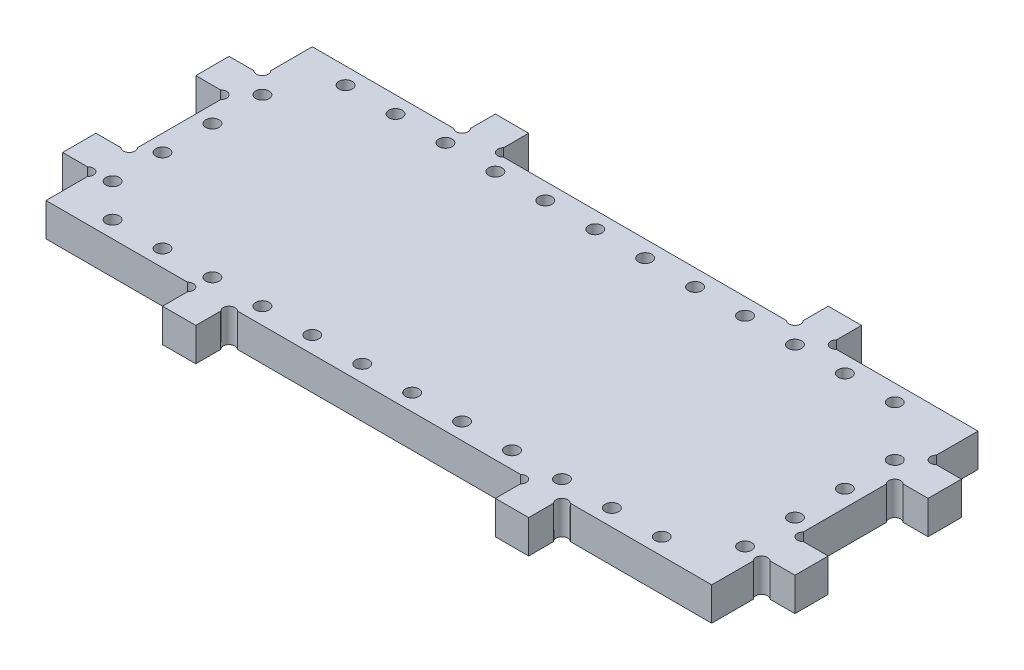
from build123d import *

# Parameters (mm, degrees)
SKETCH2_W                  = 254
SKETCH2_H                  = 101.6
RECTANGLE_EXTRUSION_DEPTH  = 12.7
SKETCH4_W                  = 12.7
SKETCH4_H                  = 12.7
FRONT_FACE_TABS_DEPTH      = 12.7
SKETCH6_R                  = 2.24536
TAB_CURVE_FRONT_BACK_DEPTH = 12.7
SKETCH7_W                  = 12.7
SKETCH7_H                  = 12.7
RIGHT_FACE_TABS_DEPTH      = 12.7
SKETCH8_R                  = 2.24536
TAB_CURVE_LEFT_RIGHT_DEPTH = 12.7
SKETCH9_R                  = 2.5527
CUT_EXTRUDE1_DEPTH         = 154.979316793


with BuildPart() as part:
    # Sketch2 → Rectangle Extrusion (new body)
    with BuildSketch(Plane(origin=(0, 0, 0), x_dir=(1, 0, 0), z_dir=(0, 1, 0))):
        Rectangle(SKETCH2_W, SKETCH2_H)
    extrude(amount=RECTANGLE_EXTRUSION_DEPTH)

    # Sketch4 → Front Face Tabs (add)
    with BuildSketch(Plane.XY.offset(50.8)):
        with Locations((-63.5, 6.35)):
            Rectangle(SKETCH4_W, SKETCH4_H)
        with Locations((63.5, 6.35)):
            Rectangle(SKETCH4_W, SKETCH4_H)
    front_face_tabs = extrude(amount=FRONT_FACE_TABS_DEPTH)

    # Mirror Rear Face Tabs: Front Face Tabs across plane
    add(front_face_tabs.mirror(Plane.XY))

    # Sketch6 → Tab Curve Front Back (cut)
    with BuildSketch(Plane(origin=(0, 12.7, 0), x_dir=(1, 0, 0), z_dir=(0, 1, 0))):
        with Locations((-71.4375, 52.3875)):
            Circle(SKETCH6_R)
        with Locations((-55.5625, 52.3875)):
            Circle(SKETCH6_R)
        with Locations((55.5625, 52.3875)):
            Circle(SKETCH6_R)
        with Locations((71.4375, 52.3875)):
            Circle(SKETCH6_R)
        with Locations((71.4375, -52.3875)):
            Circle(SKETCH6_R)
        with Locations((55.5625, -52.3875)):
            Circle(SKETCH6_R)
        with Locations((-55.5625, -52.3875)):
            Circle(SKETCH6_R)
        with Locations((-71.4375, -52.3875)):
            Circle(SKETCH6_R)
    extrude(amount=-TAB_CURVE_FRONT_BACK_DEPTH, mode=Mode.SUBTRACT)

    # Sketch7 → Right Face Tabs (add)
    with BuildSketch(Plane(origin=(127, 0, 0), x_dir=(0, 0, -1), z_dir=(1, 0, 0))):
        with Locations((-25.4, 6.35)):
            Rectangle(SKETCH7_W, SKETCH7_H)
        with Locations((25.4, 6.35)):
            Rectangle(SKETCH7_W, SKETCH7_H)
    right_face_tabs = extrude(amount=RIGHT_FACE_TABS_DEPTH)

    # Mirror Left Face Tabs: Right Face Tabs across plane
    add(right_face_tabs.mirror(Plane(origin=(0, 0, 0), x_dir=(0, 0, 1), z_dir=(1, 0, 0))))

    # Sketch8 → Tab Curve Left Right (cut)
    with BuildSketch(Plane(origin=(0, 12.7, 0), x_dir=(1, 0, 0), z_dir=(0, 1, 0))):
        with Locations((128.5875, 33.3375)):
            Circle(SKETCH8_R)
        with Locations((128.5875, 17.4625)):
            Circle(SKETCH8_R)
        with Locations((128.5875, -17.4625)):
            Circle(SKETCH8_R)
        with Locations((128.5875, -33.3375)):
            Circle(SKETCH8_R)
        with Locations((-128.5875, -33.3375)):
            Circle(SKETCH8_R)
        with Locations((-128.5875, -17.4625)):
            Circle(SKETCH8_R)
        with Locations((-128.5875, 17.4625)):
            Circle(SKETCH8_R)
        with Locations((-128.5875, 33.3375)):
            Circle(SKETCH8_R)
    extrude(amount=-TAB_CURVE_LEFT_RIGHT_DEPTH, mode=Mode.SUBTRACT)

    # Sketch9 → Cut-Extrude1 (cut, through all)
    with BuildSketch(Plane.XZ):
        with Locations(Location((-107.95, 44.45, 0), (0, 0, 270))):
            Circle(SKETCH9_R)
        with Locations(Location((-120.65, 31.75, 0), (0, 0, 270))):
            Circle(SKETCH9_R)
        with Locations(Location((-120.65, 12.7, 0), (0, 0, 270))):
            Circle(SKETCH9_R)
        with Locations(Location((-120.65, -6.35, 0), (0, 0, 270))):
            Circle(SKETCH9_R)
        with Locations(Location((-120.65, -25.4, 0), (0, 0, 270))):
            Circle(SKETCH9_R)
        with Locations(Location((-88.9, 44.45, 0), (0, 0, 270))):
            Circle(SKETCH9_R)
        with Locations(Location((-69.85, 44.45, 0), (0, 0, 270))):
            Circle(SKETCH9_R)
        with Locations(Location((-50.8, 44.45, 0), (0, 0, 270))):
            Circle(SKETCH9_R)
        with Locations(Location((-31.75, 44.45, 0), (0, 0, 270))):
            Circle(SKETCH9_R)
        with Locations(Location((-12.7, 44.45, 0), (0, 0, 270))):
            Circle(SKETCH9_R)
        with Locations(Location((6.35, 44.45, 0), (0, 0, 270))):
            Circle(SKETCH9_R)
        with Locations(Location((25.4, 44.45, 0), (0, 0, 270))):
            Circle(SKETCH9_R)
        with Locations(Location((44.45, 44.45, 0), (0, 0, 270))):
            Circle(SKETCH9_R)
        with Locations(Location((63.5, 44.45, 0), (0, 0, 270))):
            Circle(SKETCH9_R)
        with Locations(Location((82.55, 44.45, 0), (0, 0, 270))):
            Circle(SKETCH9_R)
        with Locations(Location((101.6, 44.45, 0), (0, 0, 270))):
            Circle(SKETCH9_R)
        with Locations(Location((101.6, -44.45, 0), (0, 0, 90))):
            Circle(SKETCH9_R)
        with Locations(Location((82.55, -44.45, 0), (0, 0, 90))):
            Circle(SKETCH9_R)
        with Locations(Location((63.5, -44.45, 0), (0, 0, 90))):
            Circle(SKETCH9_R)
        with Locations(Location((44.45, -44.45, 0), (0, 0, 90))):
            Circle(SKETCH9_R)
        with Locations(Location((25.4, -44.45, 0), (0, 0, 90))):
            Circle(SKETCH9_R)
        with Locations(Location((6.35, -44.45, 0), (0, 0, 90))):
            Circle(SKETCH9_R)
        with Locations(Location((-12.7, -44.45, 0), (0, 0, 90))):
            Circle(SKETCH9_R)
        with Locations(Location((-31.75, -44.45, 0), (0, 0, 90))):
            Circle(SKETCH9_R)
        with Locations(Location((-50.8, -44.45, 0), (0, 0, 90))):
            Circle(SKETCH9_R)
        with Locations(Location((-69.85, -44.45, 0), (0, 0, 90))):
            Circle(SKETCH9_R)
        with Locations(Location((-88.9, -44.45, 0), (0, 0, 90))):
            Circle(SKETCH9_R)
        with Locations(Location((-107.95, -44.45, 0), (0, 0, 90))):
            Circle(SKETCH9_R)
        with Locations(Location((120.65, -25.4, 0), (0, 0, 90))):
            Circle(SKETCH9_R)
        with Locations(Location((120.65, -6.35, 0), (0, 0, 90))):
            Circle(SKETCH9_R)
        with Locations(Location((120.65, 12.7, 0), (0, 0, 90))):
            Circle(SKETCH9_R)
        with Locations(Location((120.65, 31.75, 0), (0, 0, 90))):
            Circle(SKETCH9_R)
    extrude(amount=-CUT_EXTRUDE1_DEPTH, mode=Mode.SUBTRACT)


solid = part.part
